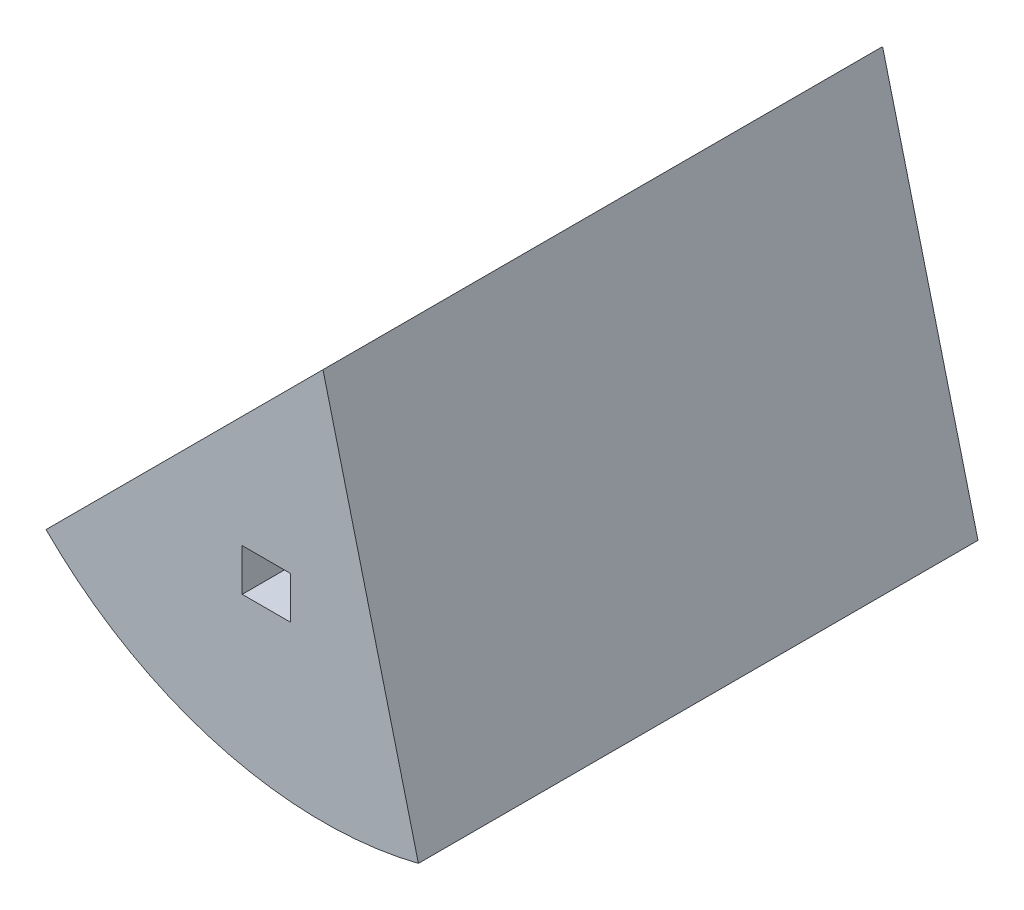
from build123d import *

# Parameters (mm, degrees)
IZIM1_R                     = 1.5
Y_KSEKLIK_EKSTR_ZYON1_DEPTH = 50
IZIM2_W                     = 4.324361658
IZIM2_H                     = 3.770180851
KES_EKSTR_ZYON1_DEPTH       = 50


with BuildPart() as part:
    # Çizim1 → Yükseklik-Ekstrüzyon1 (new body)
    with BuildSketch(Plane.XY):
        with BuildLine():
            Line((0, 0), (-24.748737342, -24.748737342))
            ThreePointArc((-24.748737342, -24.748737342), (-9.324883978, -33.734945365), (8.524559631, -33.946014245))
            Line((8.524559631, -33.946014245), (0, 0))
        make_face()
        with Locations((-5.054296408, -19.108631106)):
            Circle(IZIM1_R, mode=Mode.SUBTRACT)
    extrude(amount=Y_KSEKLIK_EKSTR_ZYON1_DEPTH)

    # Çizim2 → Kes-Ekstrüzyon1 (cut)
    with BuildSketch(Plane.XY.offset(50)):
        with Locations((-5.054296408, -19.108631106)):
            Rectangle(IZIM2_W, IZIM2_H)
    extrude(amount=-KES_EKSTR_ZYON1_DEPTH, mode=Mode.SUBTRACT)


solid = part.part
